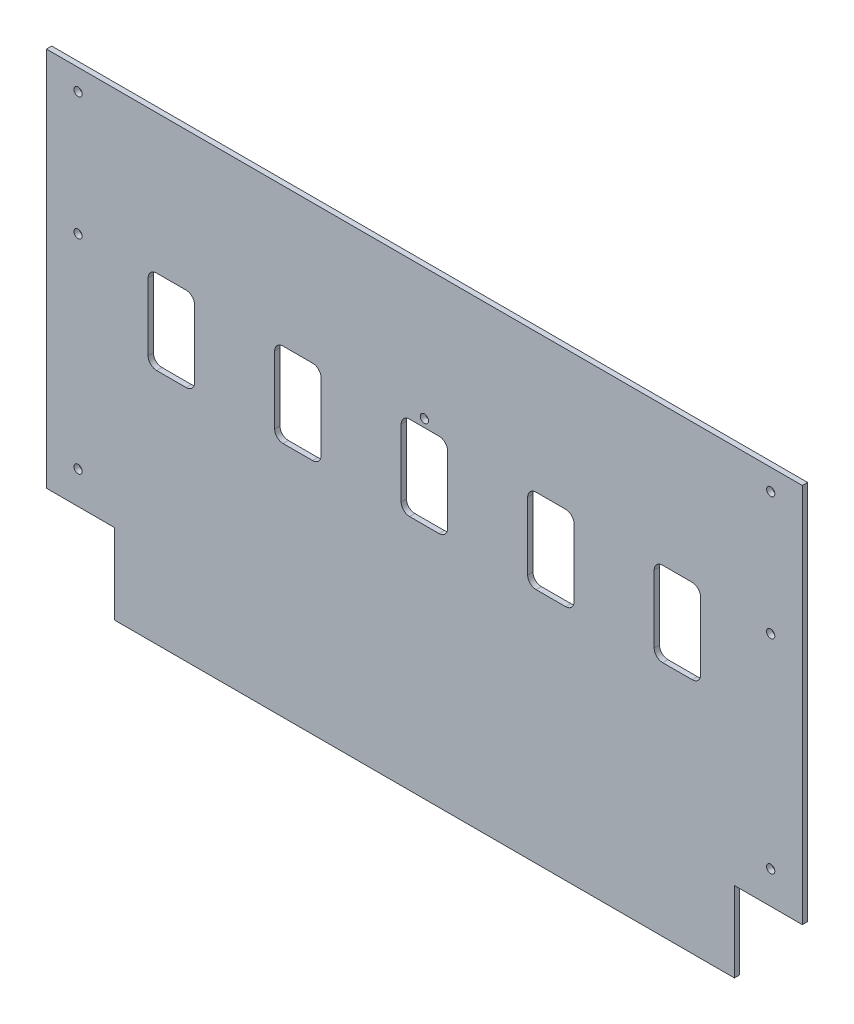
from build123d import *

# Parameters (mm, degrees)
SKETCH3_W              = 455.295
SKETCH3_H              = 277.368
BOSS_EXTRUDE1_DEPTH    = 1.5875
CUT_EXTRUDE1_DEPTH     = 25.4
SKETCH8_W              = 40.894
SKETCH8_H              = 48.26
CUT_EXTRUDE2_DEPTH     = 25.4
F_10_CLEARANCE_HOLE1_D = 4.9784
F_10_CLEARANCE_HOLE2_D = 4.9784


with BuildPart() as part:
    # Sketch3 → Boss-Extrude1 (new, symmetric)
    with BuildSketch(Plane.XY):
        Rectangle(SKETCH3_W, SKETCH3_H)
    extrude(amount=BOSS_EXTRUDE1_DEPTH, both=True)

    # Sketch4 → Cut-Extrude1 (cut)
    with BuildSketch(Plane.XY.offset(1.5875)):
        with BuildLine():
            Line((-161.29, 54.991001016), (-143.51, 54.991001016))
            ThreePointArc((-143.51, 54.991001016), (-139.917897552, 53.503103464), (-138.43, 49.911001016))
            Line((-138.43, 49.911001016), (-138.43, 9.271001016))
            ThreePointArc((-138.43, 9.271001016), (-139.917897552, 5.678898568), (-143.51, 4.191001016))
            Line((-143.51, 4.191001016), (-161.29, 4.191001016))
            ThreePointArc((-161.29, 4.191001016), (-164.882102448, 5.678898568), (-166.37, 9.271001016))
            Line((-166.37, 9.271001016), (-166.37, 49.911001016))
            ThreePointArc((-166.37, 49.911001016), (-164.882102448, 53.503103464), (-161.29, 54.991001016))
        make_face()
        with BuildLine():
            Line((-8.89, 54.991001016), (8.89, 54.991001016))
            ThreePointArc((8.89, 54.991001016), (12.482102448, 53.503103464), (13.97, 49.911001016))
            Line((13.97, 49.911001016), (13.97, 9.271001016))
            ThreePointArc((13.97, 9.271001016), (12.482102448, 5.678898568), (8.89, 4.191001016))
            Line((8.89, 4.191001016), (-8.89, 4.191001016))
            ThreePointArc((-8.89, 4.191001016), (-12.482102448, 5.678898568), (-13.97, 9.271001016))
            Line((-13.97, 9.271001016), (-13.97, 49.911001016))
            ThreePointArc((-13.97, 49.911001016), (-12.482102448, 53.503103464), (-8.89, 54.991001016))
        make_face()
        with BuildLine():
            Line((67.31, 54.991001016), (85.09, 54.991001016))
            ThreePointArc((85.09, 54.991001016), (88.682102448, 53.503103464), (90.17, 49.911001016))
            Line((90.17, 49.911001016), (90.17, 9.271001016))
            ThreePointArc((90.17, 9.271001016), (88.682102448, 5.678898568), (85.09, 4.191001016))
            Line((85.09, 4.191001016), (67.31, 4.191001016))
            ThreePointArc((67.31, 4.191001016), (63.717897552, 5.678898568), (62.23, 9.271001016))
            Line((62.23, 9.271001016), (62.23, 49.911001016))
            ThreePointArc((62.23, 49.911001016), (63.717897552, 53.503103464), (67.31, 54.991001016))
        make_face()
        with BuildLine():
            Line((143.51, 54.991001016), (161.29, 54.991001016))
            ThreePointArc((161.29, 54.991001016), (164.882102448, 53.503103464), (166.37, 49.911001016))
            Line((166.37, 49.911001016), (166.37, 9.271001016))
            ThreePointArc((166.37, 9.271001016), (164.882102448, 5.678898568), (161.29, 4.191001016))
            Line((161.29, 4.191001016), (143.51, 4.191001016))
            ThreePointArc((143.51, 4.191001016), (139.917897552, 5.678898568), (138.43, 9.271001016))
            Line((138.43, 9.271001016), (138.43, 49.911001016))
            ThreePointArc((138.43, 49.911001016), (139.917897552, 53.503103464), (143.51, 54.991001016))
        make_face()
        with BuildLine():
            Line((-85.09, 54.991001016), (-67.31, 54.991001016))
            ThreePointArc((-67.31, 54.991001016), (-63.717897552, 53.503103464), (-62.23, 49.911001016))
            Line((-62.23, 49.911001016), (-62.23, 9.271001016))
            ThreePointArc((-62.23, 9.271001016), (-63.717897552, 5.678898568), (-67.31, 4.191001016))
            Line((-67.31, 4.191001016), (-85.09, 4.191001016))
            ThreePointArc((-85.09, 4.191001016), (-88.682102448, 5.678898568), (-90.17, 9.271001016))
            Line((-90.17, 9.271001016), (-90.17, 49.911001016))
            ThreePointArc((-90.17, 49.911001016), (-88.682102448, 53.503103464), (-85.09, 54.991001016))
        make_face()
    extrude(amount=-CUT_EXTRUDE1_DEPTH, mode=Mode.SUBTRACT)

    # Sketch8 → Cut-Extrude2 (cut)
    with BuildSketch(Plane.XY.offset(1.5875)):
        with Locations((-207.2005, -114.554)):
            Rectangle(SKETCH8_W, SKETCH8_H)
        with Locations((207.2005, -114.554)):
            Rectangle(SKETCH8_W, SKETCH8_H)
    extrude(amount=-CUT_EXTRUDE2_DEPTH, mode=Mode.SUBTRACT)

    # #10 Clearance Hole1 (through all)
    with Locations(Plane.XY.offset(1.5875)):
        with Locations((208.5975, 125.984), (208.5975, 51.816), (208.5975, -70.866), (-208.5975, -70.866), (-208.5975, 51.816), (-208.5975, 125.984)):
            Hole(F_10_CLEARANCE_HOLE1_D / 2)

    # #10 Clearance Hole2 (through all)
    with Locations(Plane(origin=(0, 0, -1.5875), x_dir=(-1, 0, 0), z_dir=(0, 0, -1))):
        with Locations((0, 59.7535)):
            Hole(F_10_CLEARANCE_HOLE2_D / 2)


solid = part.part
